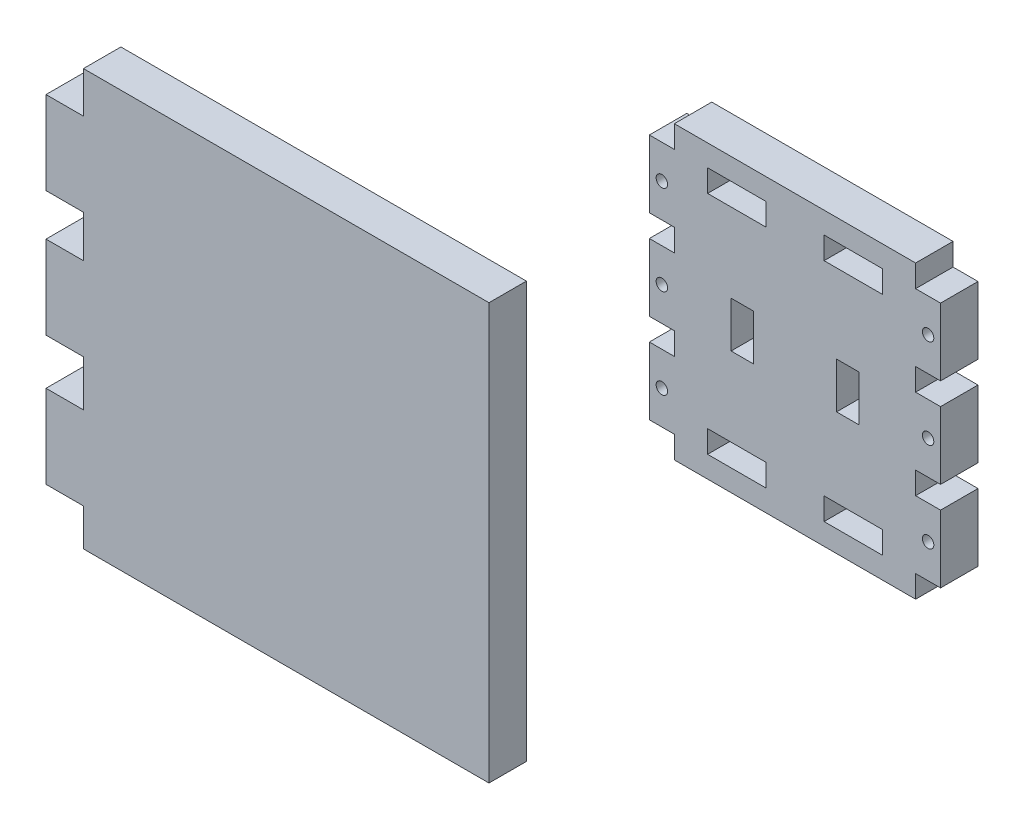
from build123d import *

# Parameters (mm, degrees)
MODEL_R               = 1.375
MODEL_W               = 14
MODEL_H               = 5.35
MODEL_W_2             = 5.35
MODEL_H_2             = 11
BOSS_EXTRUDE1_DEPTH   = 9
BOSS_EXTRUDE1_2_DEPTH = 9


with BuildPart() as part:
    # Model → Boss-Extrude1 (new body)
    with BuildSketch(Plane.XY):
        Polygon((93.296383478, 89.545101684), (151.296383478, 89.545101684), (151.296383478, 94.895101684), (157.296383478, 94.895101684), (157.296383478, 111.095101684), (151.296383478, 111.095101684), (151.296383478, 116.445101684), (157.296383478, 116.445101684), (157.296383478, 132.645101684), (151.296383478, 132.645101684), (151.296383478, 137.995101684), (157.296383478, 137.995101684), (157.296383478, 154.195101684), (151.296383478, 154.195101684), (151.296383478, 159.545101684), (93.296383478, 159.545101684), (93.296383478, 154.195101684), (87.296383478, 154.195101684), (87.296383478, 137.995101684), (93.296383478, 137.995101684), (93.296383478, 132.645101684), (87.296383478, 132.645101684), (87.296383478, 116.445101684), (93.296383478, 116.445101684), (93.296383478, 111.095101684), (87.296383478, 111.095101684), (87.296383478, 94.895101684), (93.296383478, 94.895101684), align=None)
        with Locations((90.296383478, 146.095101684)):
            Circle(MODEL_R, mode=Mode.SUBTRACT)
        with Locations(Location((154.296383478, 146.095101684, 0), (0, 0, 180))):
            Circle(MODEL_R, mode=Mode.SUBTRACT)
        with Locations((154.296383478, 102.995101684)):
            Circle(MODEL_R, mode=Mode.SUBTRACT)
        with Locations(Location((90.296383478, 102.995101684, 0), (0, 0, 180))):
            Circle(MODEL_R, mode=Mode.SUBTRACT)
        with Locations((90.296383478, 124.545101684)):
            Circle(MODEL_R, mode=Mode.SUBTRACT)
        with Locations(Location((154.296383478, 124.545101684, 0), (0, 0, 180))):
            Circle(MODEL_R, mode=Mode.SUBTRACT)
        with Locations((108.296383478, 151.700101684)):
            Rectangle(MODEL_W, MODEL_H, mode=Mode.SUBTRACT)
        with Locations((136.296383478, 151.700101684)):
            Rectangle(MODEL_W, MODEL_H, mode=Mode.SUBTRACT)
        with Locations((136.296383478, 97.390101684)):
            Rectangle(MODEL_W, MODEL_H, mode=Mode.SUBTRACT)
        with Locations((108.296383478, 97.390101684)):
            Rectangle(MODEL_W, MODEL_H, mode=Mode.SUBTRACT)
        with Locations((109.621383478, 124.545101684)):
            Rectangle(MODEL_W_2, MODEL_H_2, mode=Mode.SUBTRACT)
        with Locations((134.971383478, 124.545101684)):
            Rectangle(MODEL_W_2, MODEL_H_2, mode=Mode.SUBTRACT)
    extrude(amount=BOSS_EXTRUDE1_DEPTH)


with BuildPart() as body_2:
    # Model → Boss-Extrude1 2 (new body)
    with BuildSketch(Plane.XY):
        Polygon((-48.743128598, 90.090149077), (-57.743128598, 90.090149077), (-57.743128598, 70.090149077), (-48.743128598, 70.090149077), (-48.743128598, 60), (-57.743128598, 60), (-57.743128598, 40), (-48.743128598, 40), (-48.743128598, 28.943501612), (-57.743128598, 28.943501612), (-57.743128598, 8.943501612), (-48.743128598, 8.943501612), (-48.743128598, 0), (48.743128598, 0), (48.743128598, 100), (-48.743128598, 100), align=None)
    extrude(amount=BOSS_EXTRUDE1_2_DEPTH)


solid = Compound([part.part, body_2.part])
